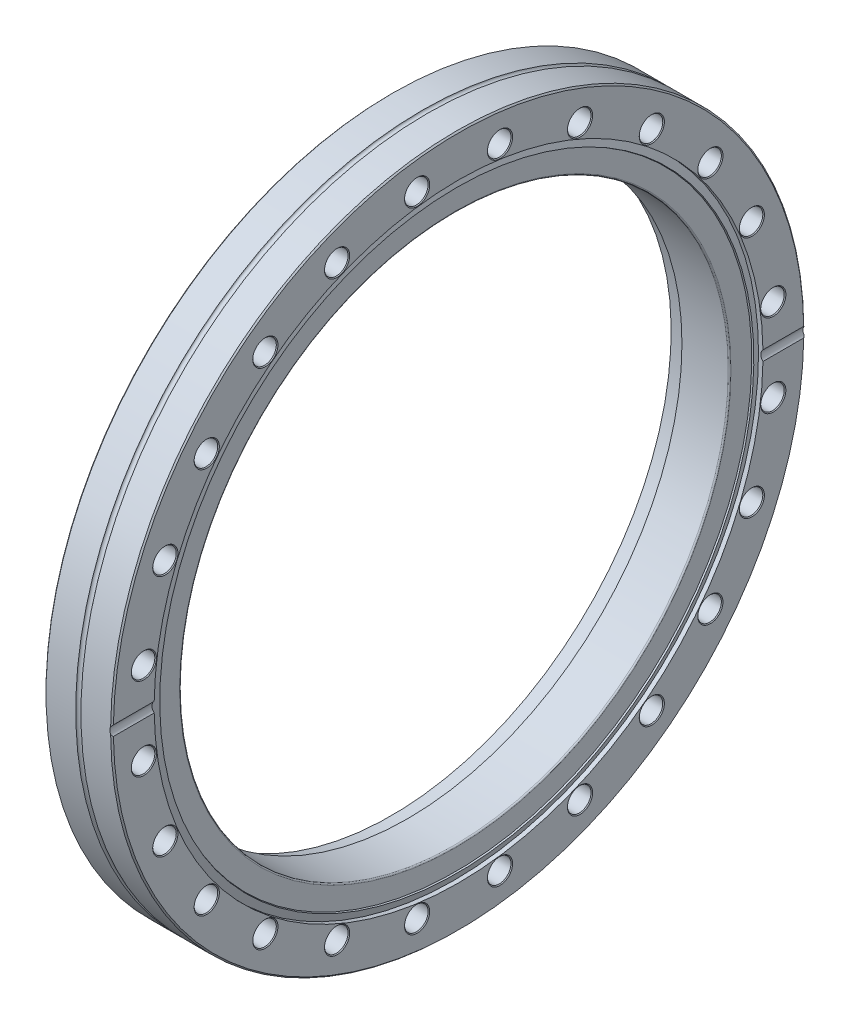
from build123d import *

# Parameters (mm, degrees)
PATTERN_CIRCULAR_3_COUNT = 24
SKETCH_6_R               = 2.5
CUT_EXTRUDE_1_DEPTH      = 17
PATTERN_CIRCULAR_2_COUNT = 2


with BuildPart() as part:
    # Эскиз1 → Повернуть2 (revolve)
    with BuildSketch(Plane.XY):
        with BuildLine():
            Line((-13.603939201, 126.6), (-24.45, 126.6))
            Line((-24.45, 126.6), (-24.95, 126.1))
            Line((-24.95, 126.1), (-24.95, 102.25))
            Line((-24.95, 102.25), (-18.95, 102.25))
            Line((-18.95, 102.25), (-18.95, 100.2))
            Line((-18.95, 100.2), (-2.05, 100.2))
            ThreePointArc((-2.05, 100.2), (-1.696446609, 100.346446609), (-1.55, 100.7))
            Line((-1.55, 100.7), (-1.55, 108.299816371))
            Line((-1.55, 108.299816371), (-1, 108.5))
            Line((-1, 108.5), (-1.982719633, 111.2))
            Line((-1.982719633, 111.2), (-0.35, 111.2))
            Line((-0.35, 111.2), (-0.35, 126.1))
            Line((-0.35, 126.1), (-0.85, 126.6))
            Line((-0.85, 126.6), (-11.696060799, 126.6))
            ThreePointArc((-11.696060799, 126.6), (-12.65, 125.9), (-13.603939201, 126.6))
        make_face()
    revolve(axis=Axis((0, 0, 0), (-1, 0, 0)))

    # Эскиз2 → Отверстие с зазором M81 (revolve, cut)
    with BuildSketch(Plane(origin=(-0.35, 114.958031676, -15.134511988), x_dir=(0, 0, -1), z_dir=(0, 1, 0))):
        Polygon((0, 0), (0, 24.6), (4.6, 24.6), (4.3, 24.3), (4.3, 0.3), (4.6, 0), align=None)
    hole_wizard_m81 = revolve(axis=Axis((6, 114.958031676, -15.134511988), (-1, 0, 0)), mode=Mode.SUBTRACT)

    # Круговой массив3: Отверстие с зазором M81 ×24 about axis
    pattern_circular_3_axis = Axis((-110.150658921, 0, 0), (1, 0, 0))
    for i in range(1, PATTERN_CIRCULAR_3_COUNT):
        add(hole_wizard_m81.rotate(pattern_circular_3_axis, i * 360 / PATTERN_CIRCULAR_3_COUNT), mode=Mode.SUBTRACT)

    # Эскиз6 → Вырез-Вытянуть1 (cut)
    with BuildSketch(Plane.XY.offset(126.6)):
        with Locations((1.35, 0)):
            Circle(SKETCH_6_R)
    cut_extrude_1 = extrude(amount=-CUT_EXTRUDE_1_DEPTH, mode=Mode.SUBTRACT)

    # Круговой массив2: Вырез-Вытянуть1 ×2 about axis
    pattern_circular_2_axis = Axis((-110.150658921, 0, 0), (1, 0, 0))
    for i in range(1, PATTERN_CIRCULAR_2_COUNT):
        add(cut_extrude_1.rotate(pattern_circular_2_axis, i * 360 / PATTERN_CIRCULAR_2_COUNT), mode=Mode.SUBTRACT)


solid = part.part
